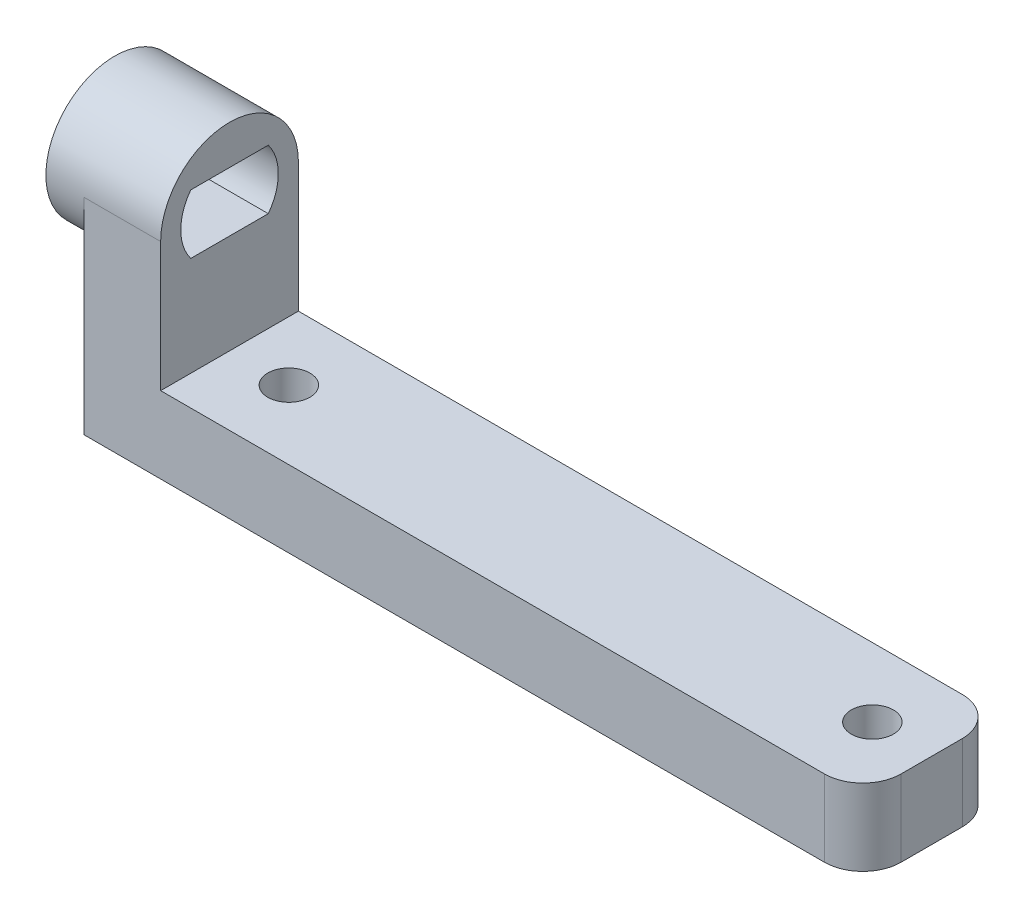
from build123d import *

# Parameters (mm, degrees)
SKETCH1_W           = 36.7
SKETCH1_H           = 7.2
SKETCH1_R           = 1.1
BOSS_EXTRUDE1_DEPTH = 4
SKETCH2_W           = 4
SKETCH2_H           = 7.2
BOSS_EXTRUDE2_DEPTH = 10.75
SKETCH3_R           = 3.6
BOSS_EXTRUDE3_DEPTH = 6
FILLET1_R           = 2
CUT_EXTRUDE1_DEPTH  = 6


with BuildPart() as part:
    # Sketch1 → Boss-Extrude1 (new body)
    with BuildSketch(Plane(origin=(0, 0, 0), x_dir=(1, 0, 0), z_dir=(0, 1, 0))):
        Rectangle(SKETCH1_W, SKETCH1_H)
        with Locations(Location((15.25, 0, 0), (0, 0, 270))):
            Circle(SKETCH1_R, mode=Mode.SUBTRACT)
        with Locations(Location((-15.25, 0, 0), (0, 0, 270))):
            Circle(SKETCH1_R, mode=Mode.SUBTRACT)
    extrude(amount=BOSS_EXTRUDE1_DEPTH)

    # Sketch2 → Boss-Extrude2 (add)
    with BuildSketch(Plane.XZ):
        with Locations((-20.35, 0)):
            Rectangle(SKETCH2_W, SKETCH2_H)
    extrude(amount=-BOSS_EXTRUDE2_DEPTH)

    # Sketch3 → Boss-Extrude3 (add)
    with BuildSketch(Plane(origin=(-18.35, 0, 0), x_dir=(0, 0, -1), z_dir=(1, 0, 0))):
        with Locations((0, 10.75)):
            Circle(SKETCH3_R)
    extrude(amount=-BOSS_EXTRUDE3_DEPTH)

    # Fillet1
    fillet1_edges = [part.edges().sort_by_distance(p)[0] for p in [
        (18.35, 2, -3.6),
        (18.35, 2, 3.6),
    ]]
    fillet(fillet1_edges, radius=FILLET1_R)

    # Sketch4 → Cut-Extrude1 (cut)
    with BuildSketch(Plane.ZY.offset(24.35)):
        with BuildLine():
            Line((-2.024845673, 9.2), (0, 9.2))
            Line((0, 9.2), (0, 12.3))
            Line((0, 12.3), (-2.024845673, 12.3))
            ThreePointArc((-2.024845673, 12.3), (-2.55, 10.75), (-2.024845673, 9.2))
        make_face()
        with BuildLine():
            Line((0, 12.3), (0, 9.2))
            Line((0, 9.2), (2.024845673, 9.2))
            ThreePointArc((2.024845673, 9.2), (2.415145593, 9.93172635), (2.55, 10.75))
            ThreePointArc((2.55, 10.75), (2.415145593, 11.56827365), (2.024845673, 12.3))
            Line((2.024845673, 12.3), (0, 12.3))
        make_face()
    extrude(amount=-CUT_EXTRUDE1_DEPTH, mode=Mode.SUBTRACT)


solid = part.part
